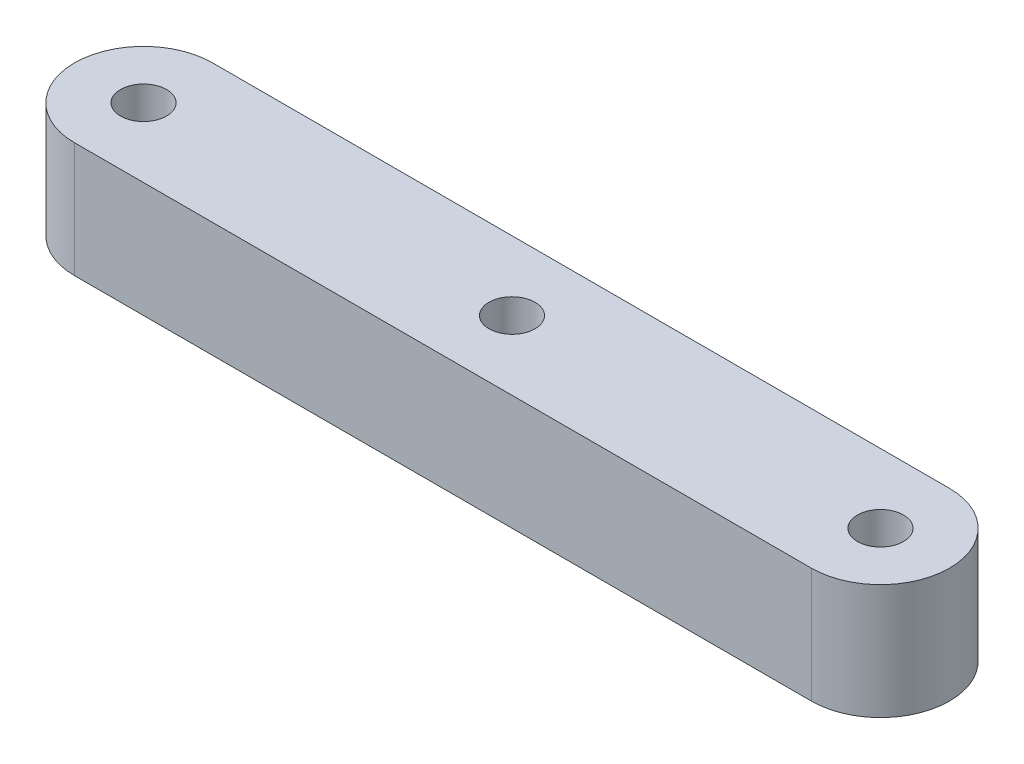
from build123d import *

# Parameters (mm, degrees)
BOSS_EXTRUDE1_DEPTH = 12.7
SKETCH4_R           = 2.54
CUT_EXTRUDE3_DEPTH  = 61.26815743


with BuildPart() as part:
    # Sketch3 → Boss-Extrude1 (new body)
    with BuildSketch(Plane(origin=(0, 0, 0), x_dir=(1, 0, 0), z_dir=(0, 1, 0))):
        with BuildLine():
            Line((-50.8, 7.62), (30.48, 7.62))
            ThreePointArc((30.48, 7.62), (38.1, 0), (30.48, -7.62))
            Line((30.48, -7.62), (-50.8, -7.62))
            ThreePointArc((-50.8, -7.62), (-58.42, 0), (-50.8, 7.62))
        make_face()
    extrude(amount=BOSS_EXTRUDE1_DEPTH)

    # Sketch4 → Cut-Extrude3 (cut, through all)
    with BuildSketch(Plane(origin=(0, 12.7, 0), x_dir=(1, 0, 0), z_dir=(0, 1, 0))):
        with Locations(Location((-50.8, 0, 0), (0, 0, 270))):
            Circle(SKETCH4_R)
        with Locations(Location((30.48, 0, 0), (0, 0, 90))):
            Circle(SKETCH4_R)
        with Locations(Location((-10.16, 0, 0), (0, 0, 270))):
            Circle(SKETCH4_R)
    extrude(amount=-CUT_EXTRUDE3_DEPTH, mode=Mode.SUBTRACT)


solid = part.part
